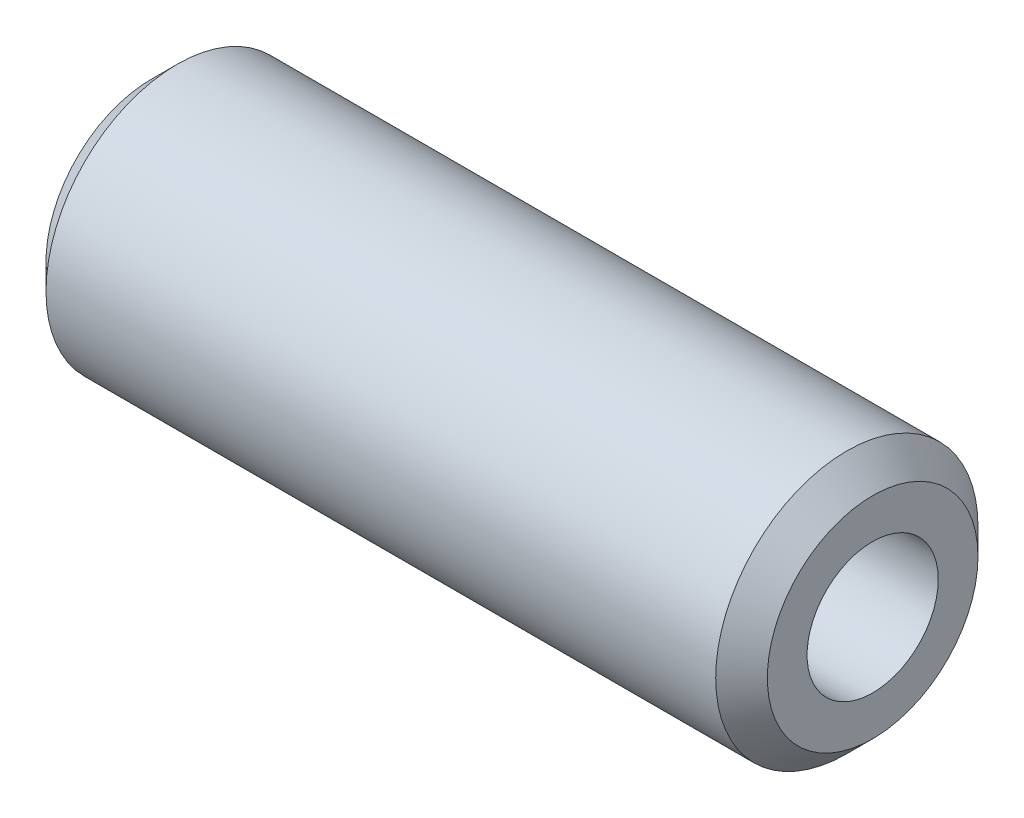
from build123d import *

# Parameters (mm, degrees)
SKETCH1_R           = 12.7
SKETCH1_R_2         = 6.35
BOSS_EXTRUDE1_DEPTH = 34.925
CHAMFER1_SIZE       = 2.5


with BuildPart() as part:
    # Sketch1 → Boss-Extrude1 (new, symmetric)
    with BuildSketch(Plane.YZ):
        with Locations(Location((0, 0, 0), (0, 0, 270))):
            Circle(SKETCH1_R)
        with Locations(Location((0, 0, 0), (0, 0, 270))):
            Circle(SKETCH1_R_2, mode=Mode.SUBTRACT)
    extrude(amount=BOSS_EXTRUDE1_DEPTH, both=True)

    # Chamfer1
    chamfer1_edges = [part.edges().sort_by_distance(p)[0] for p in [
        (-34.925, 0, 12.7),
        (34.925, 0, 12.7),
    ]]
    chamfer(chamfer1_edges, length=CHAMFER1_SIZE)


solid = part.part
